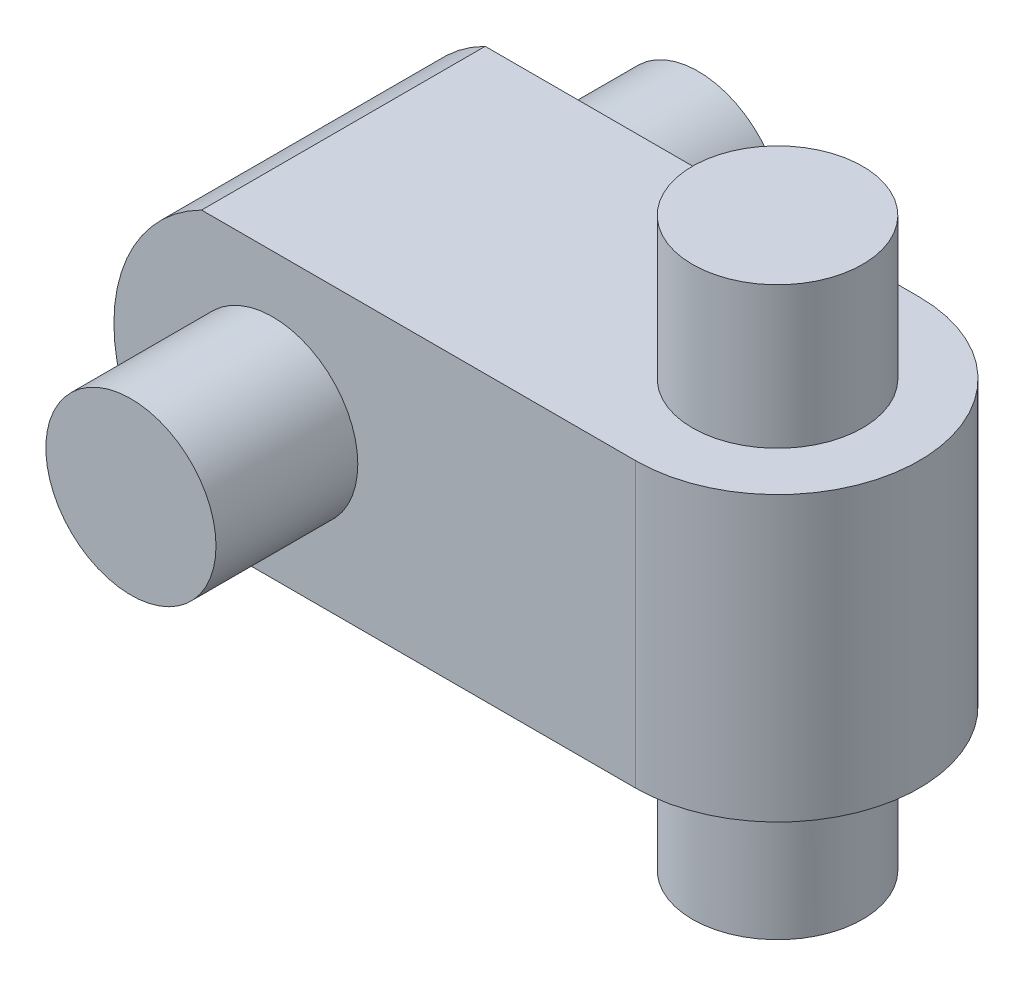
from build123d import *

# Parameters (mm, degrees)
SALIENTE_EXTRUIR1_DEPTH = 25
CORTAR_EXTRUIR1_DEPTH   = 60
CORTAR_EXTRUIR2_DEPTH   = 50
CROQUIS16_R             = 7.5
SALIENTE_EXTRUIR4_DEPTH = 25
CROQUIS19_R             = 7.5
SALIENTE_EXTRUIR5_DEPTH = 25


with BuildPart() as part:
    # Croquis1 → Saliente-Extruir1 (new body)
    with BuildSketch(Plane.XY):
        with BuildLine():
            Line((38.847221771, 29.508698958), (38.847221771, 42.008698958))
            Line((38.847221771, 42.008698958), (-6.152778229, 43.508698958))
            ThreePointArc((-6.152778229, 43.508698958), (-20.152778229, 29.508698958), (-6.152778229, 15.508698958))
            Line((-6.152778229, 15.508698958), (38.847221771, 17.008698958))
            Line((38.847221771, 17.008698958), (38.847221771, 29.508698958))
        make_face()
    extrude(amount=SALIENTE_EXTRUIR1_DEPTH)

    # Croquis5 → Cortar-Extruir1 (cut)
    with BuildSketch(Plane(origin=(0, 0, 0), x_dir=(1, 0, 0), z_dir=(0, 1, 0))):
        with BuildLine():
            Line((25.847221771, 0), (38.847221771, 0))
            Line((38.847221771, 0), (38.847221771, -25))
            Line((38.847221771, -25), (25.847221771, -25))
            ThreePointArc((25.847221771, -25), (38.347221771, -12.5), (25.847221771, 0))
        make_face()
    extrude(amount=CORTAR_EXTRUIR1_DEPTH, mode=Mode.SUBTRACT)

    # Croquis14 → Cortar-Extruir2 (cut)
    with BuildSketch(Plane.XY):
        Polygon((53.899517017, 17.025365624), (35.13924076, 17.025365624), (-30.270251596, 17.025365624), (-30.270251596, 4.764452962), (53.899517017, 4.764452962), align=None)
        Polygon((-30.270251596, 42.025365624), (38.347221771, 42.025365624), (49.932931428, 42.025365624), (49.932931428, 48.139642848), (-30.270251596, 48.139642848), align=None)
    extrude(amount=CORTAR_EXTRUIR2_DEPTH, mode=Mode.SUBTRACT)

    # Croquis16 → Saliente-Extruir4 (add, symmetric)
    with BuildSketch(Plane(origin=(0, 29.508698958, 0), x_dir=(1, 0, 0), z_dir=(0, 1, 0))):
        with Locations(Location((25.847221771, -12.5, 0), (0, 0, 180))):
            Circle(CROQUIS16_R)
    extrude(amount=SALIENTE_EXTRUIR4_DEPTH, both=True)

    # Croquis19 → Saliente-Extruir5 (add, symmetric)
    with BuildSketch(Plane.XY.offset(12.5)):
        with Locations((-6.152778229, 29.508698958)):
            Circle(CROQUIS19_R)
    extrude(amount=SALIENTE_EXTRUIR5_DEPTH, both=True)


solid = part.part
